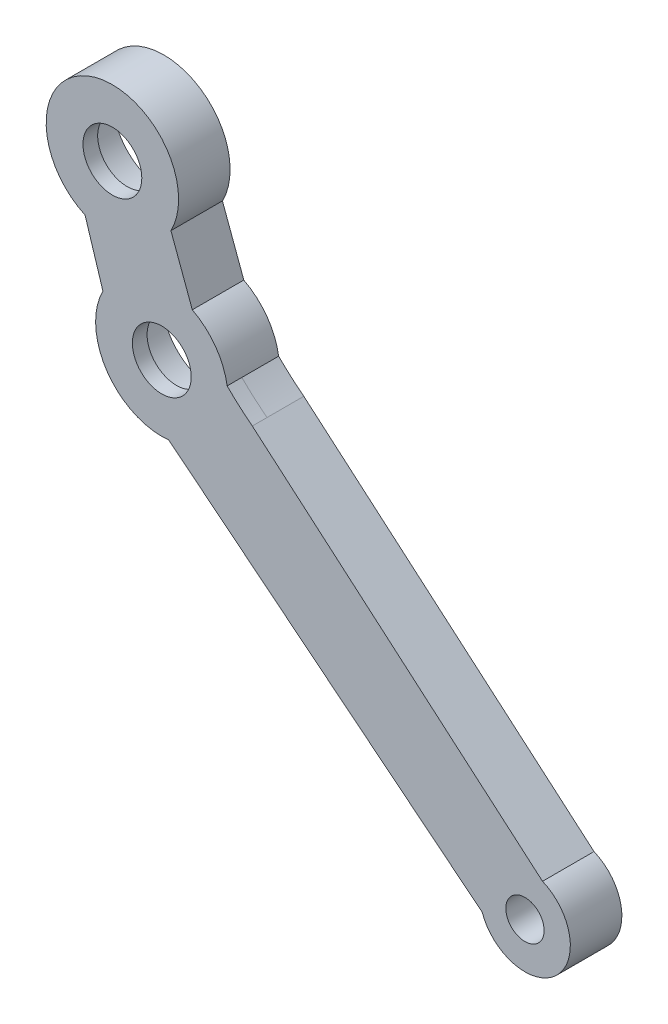
from build123d import *

# Parameters (mm, degrees)
SKETCH1_R           = 6.901519969
SKETCH1_R_2         = 6.9
SKETCH1_R_3         = 2.6
BOSS_EXTRUDE1_DEPTH = 5
SKETCH2_R           = 4
SKETCH2_R_2         = 2.6
BOSS_EXTRUDE2_DEPTH = 2
SCALE1_SCALE        = 1.5


with BuildPart() as part:
    # Sketch1 → Boss-Extrude1 (new body)
    with BuildSketch(Plane.XY):
        with BuildLine():
            Line((-119.047770685, -14.21840763), (-158.491736924, 19.646141241))
            add(Edge.make_bspline(
                [(-158.491736924, 19.646141241), (-160.313597407, 21.050397122), (-161.909962094, 22.656519407)],
                knots=[0, 0, 0, 1, 1, 1], degree=2))
            ThreePointArc((-161.909962094, 22.656519407), (-163.491640093, 26.517106064), (-166.64545249, 29.248278339))
            Line((-166.64545249, 29.248278339), (-169.551288031, 37.112526103))
            ThreePointArc((-169.551288031, 37.112526103), (-180.421756419, 49.833075564), (-181.222431589, 33.119656379))
            Line((-181.222431589, 33.119656379), (-178.794316039, 25.37582765))
            ThreePointArc((-178.794316039, 25.37582765), (-178.212831269, 16.189990788), (-169.857983808, 12.328093938))
            Line((-169.857983808, 12.328093938), (-127.253789064, -21.937441374))
            ThreePointArc((-127.253789064, -21.937441374), (-117.207191003, -24.396487309), (-119.047770685, -14.21840763))
        make_face()
        with Locations((-170.794274728, 21.270925714)):
            Circle(SKETCH1_R, mode=Mode.SUBTRACT)
        with Locations((-177.508495403, 41.317624299)):
            Circle(SKETCH1_R_2, mode=Mode.SUBTRACT)
        with Locations((-121.432089481, -19.905045023)):
            Circle(SKETCH1_R_3, mode=Mode.SUBTRACT)
    extrude(amount=BOSS_EXTRUDE1_DEPTH)

    # Sketch2 → Boss-Extrude2 (add)
    with BuildSketch(Plane.XY.offset(5)):
        with BuildLine():
            Line((-119.047770685, -14.21840763), (-158.491736924, 19.646141241))
            add(Edge.make_bspline(
                [(-158.491736924, 19.646141241), (-160.313597387, 21.050397106), (-161.909962058, 22.656519371)],
                knots=[0, 0, 0, 1, 1, 1], degree=2))
            ThreePointArc((-161.909962058, 22.656519371), (-163.491640057, 26.517106064), (-166.64545249, 29.248278339))
            Line((-166.64545249, 29.248278339), (-169.551288031, 37.112526103))
            ThreePointArc((-169.551288031, 37.112526103), (-180.421756419, 49.833075564), (-181.222431589, 33.119656379))
            Line((-181.222431589, 33.119656379), (-178.794316039, 25.37582765))
            ThreePointArc((-178.794316039, 25.37582765), (-178.212831269, 16.189990788), (-169.857983808, 12.328093938))
            Line((-169.857983808, 12.328093938), (-127.253789064, -21.937441374))
            ThreePointArc((-127.253789064, -21.937441374), (-117.207191003, -24.396487309), (-119.047770685, -14.21840763))
        make_face()
        with Locations((-177.508495403, 41.317624299)):
            Circle(SKETCH2_R, mode=Mode.SUBTRACT)
        with Locations((-170.794274728, 21.270925714)):
            Circle(SKETCH2_R, mode=Mode.SUBTRACT)
        with Locations((-121.432089481, -19.905045023)):
            Circle(SKETCH2_R_2, mode=Mode.SUBTRACT)
    extrude(amount=BOSS_EXTRUDE2_DEPTH)


with BuildPart() as part_1:
    # Scale1: scaled about (-152.018458466, 8.096190601, 3.636452689)
    add(part.part.scale(SCALE1_SCALE).moved(Location((76.009229233, -4.0480953, -1.818226344))))


solid = part_1.part
